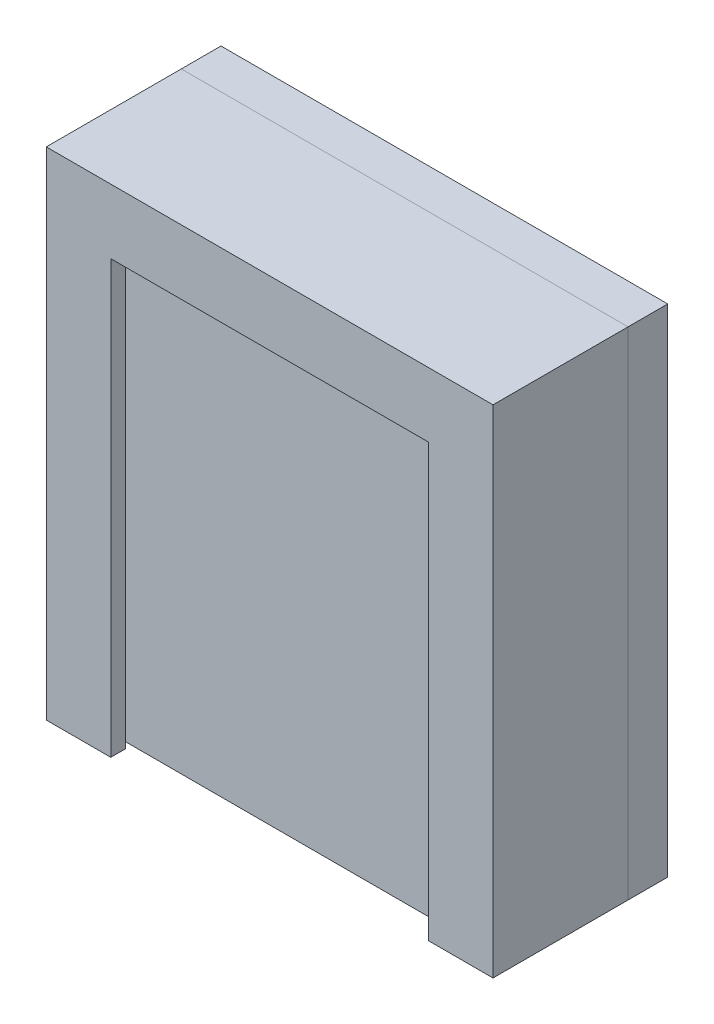
from build123d import *

# Parameters (mm, degrees)
ESBO_O1_W                = 90
ESBO_O1_H                = 100
RESSALTO_EXTRUS_O1_DEPTH = 5
RESSALTO_EXTRUS_O2_DEPTH = 1.2
RESSALTO_EXTRUS_O3_DEPTH = 3
ESBO_O5_W                = 90
ESBO_O5_H                = 100
ESBO_O5_W_2              = 80
ESBO_O5_H_2              = 90
RESSALTO_EXTRUS_O5_DEPTH = 18
RESSALTO_EXTRUS_O6_DEPTH = 4
RESSALTO_EXTRUS_O7_DEPTH = 4
ESBO_O10_W               = 80
ESBO_O10_H               = 18
CORTE_EXTRUS_O3_DEPTH    = 14


with BuildPart() as part:
    # Esboço1 → Ressalto-extrusão1 (new body)
    with BuildSketch(Plane.XY):
        Rectangle(ESBO_O1_W, ESBO_O1_H)
    extrude(amount=RESSALTO_EXTRUS_O1_DEPTH)

    # Esboço2 → Ressalto-extrusão2 (add)
    with BuildSketch(Plane.XY.offset(5)):
        Polygon((45, 50), (-45, 50), (-45, -50), (-37, -50), (-37, -42), (-37, 42), (37, 42), (37, -42), (37, -50), (45, -50), align=None)
    extrude(amount=RESSALTO_EXTRUS_O2_DEPTH)

    # Esboço3 → Ressalto-extrusão3 (add)
    with BuildSketch(Plane.XY.offset(6.2)):
        Polygon((37, -50), (45, -50), (45, 50), (-45, 50), (-45, -50), (-37, -50), (-32, -50), (-32, 37), (32, 37), (32, -50), align=None)
    extrude(amount=RESSALTO_EXTRUS_O3_DEPTH)

    # Esboço5 → Ressalto-extrusão5 (add)
    with BuildSketch(Plane(origin=(0, 0, 0), x_dir=(-1, 0, 0), z_dir=(0, 0, -1))):
        Rectangle(ESBO_O5_W, ESBO_O5_H)
        Rectangle(ESBO_O5_W_2, ESBO_O5_H_2, mode=Mode.SUBTRACT)
    extrude(amount=RESSALTO_EXTRUS_O5_DEPTH)

    # Esboço10 → Corte-extrusão3 (cut)
    with BuildSketch(Plane(origin=(0, -45, 0), x_dir=(1, 0, 0), z_dir=(0, 1, 0))):
        with Locations((0, 9)):
            Rectangle(ESBO_O10_W, ESBO_O10_H)
    extrude(amount=-CORTE_EXTRUS_O3_DEPTH, mode=Mode.SUBTRACT)


with BuildPart() as body_2:
    # Esboço8 → Ressalto-extrusão6 (new body)
    with BuildSketch(Plane(origin=(0, 0, -18), x_dir=(-1, 0, 0), z_dir=(0, 0, -1))):
        Polygon((42.5, -50), (45, -50), (45, 50), (-45, 50), (-45, -50), (-42.5, -50), (-42.5, 47.5), (42.5, 47.5), align=None)
    extrude(amount=RESSALTO_EXTRUS_O6_DEPTH)

    # Esboço9 → Ressalto-extrusão7 (add)
    with BuildSketch(Plane(origin=(0, 0, -22), x_dir=(-1, 0, 0), z_dir=(0, 0, -1))):
        Polygon((-45, -50), (-42.5, -50), (-42.5, 47.5), (42.5, 47.5), (42.5, -50), (45, -50), (45, 50), (-45, 50), align=None)
        Polygon((42.5, -50), (40, -45), (40, 45), (-40, 45), (-40, -45), (-42.5, -50), (-42.5, 47.5), (42.5, 47.5), align=None)
    extrude(amount=RESSALTO_EXTRUS_O7_DEPTH)


solid = Compound([part.part, body_2.part])
